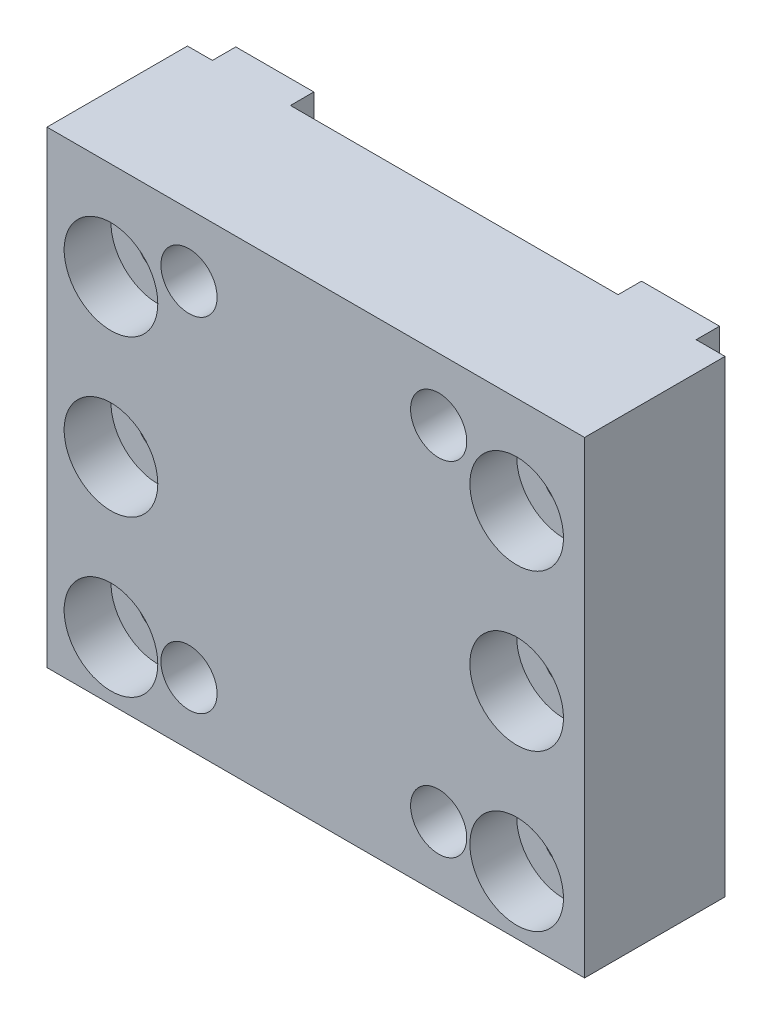
from build123d import *

# Parameters (mm, degrees)
SKETCH_1_W           = 70
SKETCH_1_H           = 30
EXTRUDE_1_DEPTH      = 9
SKETCH_2_W           = 112.1
SKETCH_2_H           = 30
EXTRUDE_2_DEPTH      = 8
SKETCH_3_W           = 42.6
SKETCH_3_H           = 30
EXTRUDE_3_DEPTH      = 8
SKETCH_5_W           = 18.5
SKETCH_5_H           = 30
SKETCH_5_R           = 2
EXTRUDE_4_DEPTH      = 5.5
SKETCH_11_R          = 2
CUT_EXTRUDE_4_DEPTH  = 8
SKETCH_12_R          = 1.8
CUT_EXTRUDE_6_DEPTH  = 8
SKETCH_13_R          = 2
CUT_EXTRUDE_7_DEPTH  = 8
SKETCH_14_R          = 2
CUT_EXTRUDE_8_DEPTH  = 10
SKETCH_19_W          = 5
SKETCH_19_H          = 9
EXTRUDE_6_DEPTH      = 36.25
SKETCH_20_W          = 5
SKETCH_20_H          = 6.25
EXTRUDE_7_DEPTH      = 9
SKETCH_21_R          = 1.3
CUT_EXTRUDE_10_DEPTH = 9
SKETCH_25_W          = 5
SKETCH_25_H          = 1.5
EXTRUDE_8_DEPTH      = 42.5
SKETCH_26_R          = 1.3
CUT_EXTRUDE_14_DEPTH = 1.5
SKETCH_27_W          = 5
SKETCH_27_H          = 6.25
CUT_EXTRUDE_15_DEPTH = 11
SKETCH_28_R          = 3
CUT_EXTRUDE_16_DEPTH = 3
SKETCH_29_W          = 8
SKETCH_29_H          = 103.1
SKETCH_29_W_2        = 10.5
SKETCH_29_H_2        = 5.5
CUT_EXTRUDE_17_DEPTH = 30
SKETCH_30_R          = 1.8
CUT_EXTRUDE_18_DEPTH = 10
SKETCH_31_R          = 3.6
CUT_EXTRUDE_19_DEPTH = 3
SKETCH_32_R          = 1.8
CUT_EXTRUDE_20_DEPTH = 10
SKETCH_33_R          = 3.6
CUT_EXTRUDE_21_DEPTH = 3
CUT_EXTRUDE_22_REACH = 86.054
SKETCH_35_R          = 1.8
SKETCH_36_W          = 7.55
SKETCH_36_H          = 30
CUT_EXTRUDE_23_DEPTH = 10
SKETCH_37_W          = 18
SKETCH_37_H          = 30
SKETCH_37_W_2        = 26
CUT_EXTRUDE_24_DEPTH = 10


with BuildPart() as part:
    # 草圖1 → 填料-伸長1 (new body)
    with BuildSketch(Plane.XY):
        with Locations((35, 15)):
            Rectangle(SKETCH_1_W, SKETCH_1_H)
    extrude(amount=EXTRUDE_1_DEPTH)

    # 草圖2 → 填料-伸長2 (add)
    with BuildSketch(Plane.ZY):
        with Locations((-47.05, 15)):
            Rectangle(SKETCH_2_W, SKETCH_2_H)
    extrude(amount=EXTRUDE_2_DEPTH)

    # 草圖3 → 填料-伸長3 (add)
    with BuildSketch(Plane(origin=(70, 0, 0), x_dir=(0, 0, -1), z_dir=(1, 0, 0))):
        with Locations((12.3, 15)):
            Rectangle(SKETCH_3_W, SKETCH_3_H)
    extrude(amount=EXTRUDE_3_DEPTH)

    # 草圖5 → 填料-伸長4 (add)
    with BuildSketch(Plane(origin=(0, 0, -33.6), x_dir=(-1, 0, 0), z_dir=(0, 0, -1))):
        with Locations((-68.75, 15)):
            Rectangle(SKETCH_5_W, SKETCH_5_H)
        with Locations(Location((-65.75, 26, 0), (0, 0, 90))):
            Circle(SKETCH_5_R, mode=Mode.SUBTRACT)
        with Locations(Location((-65.75, 18, 0), (0, 0, 90))):
            Circle(SKETCH_5_R, mode=Mode.SUBTRACT)
        with Locations(Location((-65.75, 10, 0), (0, 0, 90))):
            Circle(SKETCH_5_R, mode=Mode.SUBTRACT)
    extrude(amount=EXTRUDE_4_DEPTH)

    # 草圖11 → 除料-伸長4 (cut)
    with BuildSketch(Plane.ZY.offset(8)):
        with Locations((-23, 23)):
            Circle(SKETCH_11_R)
        with Locations((-23, 15)):
            Circle(SKETCH_11_R)
        with Locations((-23, 7)):
            Circle(SKETCH_11_R)
        with Locations((-15, 23)):
            Circle(SKETCH_11_R)
        with Locations((-15, 15)):
            Circle(SKETCH_11_R)
        with Locations((-15, 7)):
            Circle(SKETCH_11_R)
        with Locations((-7, 23)):
            Circle(SKETCH_11_R)
        with Locations((-7, 15)):
            Circle(SKETCH_11_R)
        with Locations((-7, 7)):
            Circle(SKETCH_11_R)
    extrude(amount=-CUT_EXTRUDE_4_DEPTH, mode=Mode.SUBTRACT)

    # 草圖12 → 除料-伸長6 (cut)
    with BuildSketch(Plane(origin=(0, 0, -103.1), x_dir=(-1, 0, 0), z_dir=(0, 0, -1))):
        with Locations((3, 23)):
            Circle(SKETCH_12_R)
        with Locations((3, 15)):
            Circle(SKETCH_12_R)
        with Locations((3, 7)):
            Circle(SKETCH_12_R)
    extrude(amount=-CUT_EXTRUDE_6_DEPTH, mode=Mode.SUBTRACT)

    # 草圖13 → 除料-伸長7 (cut)
    with BuildSketch(Plane(origin=(78, 0, 0), x_dir=(0, 0, -1), z_dir=(1, 0, 0))):
        with Locations((9.1, 23)):
            Circle(SKETCH_13_R)
        with Locations((9.1, 15)):
            Circle(SKETCH_13_R)
        with Locations((9.1, 7)):
            Circle(SKETCH_13_R)
        with Locations((17.1, 23)):
            Circle(SKETCH_13_R)
        with Locations((17.1, 15)):
            Circle(SKETCH_13_R)
        with Locations((17.1, 7)):
            Circle(SKETCH_13_R)
        with Locations((25.1, 23)):
            Circle(SKETCH_13_R)
        with Locations((25.1, 15)):
            Circle(SKETCH_13_R)
        with Locations((25.1, 7)):
            Circle(SKETCH_13_R)
    extrude(amount=-CUT_EXTRUDE_7_DEPTH, mode=Mode.SUBTRACT)

    # 草圖14 → 除料-伸長8 (cut)
    with BuildSketch(Plane.ZY.offset(8)):
        with Locations((-85.1, 23)):
            Circle(SKETCH_14_R)
        with Locations((-85.1, 15)):
            Circle(SKETCH_14_R)
        with Locations((-85.1, 7)):
            Circle(SKETCH_14_R)
        with Locations((-77.1, 23)):
            Circle(SKETCH_14_R)
        with Locations((-77.1, 15)):
            Circle(SKETCH_14_R)
        with Locations((-77.1, 7)):
            Circle(SKETCH_14_R)
        with Locations((-69.1, 23)):
            Circle(SKETCH_14_R)
        with Locations((-69.1, 15)):
            Circle(SKETCH_14_R)
        with Locations((-69.1, 7)):
            Circle(SKETCH_14_R)
        with Locations((-61.1, 23)):
            Circle(SKETCH_14_R)
        with Locations((-61.1, 15)):
            Circle(SKETCH_14_R)
        with Locations((-61.1, 7)):
            Circle(SKETCH_14_R)
    extrude(amount=-CUT_EXTRUDE_8_DEPTH, mode=Mode.SUBTRACT)

    # 草圖19 → 填料-伸長6 (add)
    with BuildSketch(Plane(origin=(0, 30, 0), x_dir=(1, 0, 0), z_dir=(0, 1, 0))):
        with Locations((22.1, -4.5)):
            Rectangle(SKETCH_19_W, SKETCH_19_H)
        with Locations((48.1, -4.5)):
            Rectangle(SKETCH_19_W, SKETCH_19_H)
    extrude(amount=-EXTRUDE_6_DEPTH)

    # 草圖20 → 填料-伸長7 (add)
    with BuildSketch(Plane(origin=(0, 0, 0), x_dir=(-1, 0, 0), z_dir=(0, 0, -1))):
        with Locations((-48.1, 33.125)):
            Rectangle(SKETCH_20_W, SKETCH_20_H)
        with Locations((-22.1, 33.125)):
            Rectangle(SKETCH_20_W, SKETCH_20_H)
    extrude(amount=-EXTRUDE_7_DEPTH)

    # 草圖21 → 除料-伸長10 (cut)
    with BuildSketch(Plane(origin=(0, 0, 0), x_dir=(-1, 0, 0), z_dir=(0, 0, -1))):
        with Locations((-48.1, 23.75)):
            Circle(SKETCH_21_R)
        with Locations((-48.1, 13.75)):
            Circle(SKETCH_21_R)
        with Locations((-48.1, 3.75)):
            Circle(SKETCH_21_R)
        with Locations((-22.1, 23.75)):
            Circle(SKETCH_21_R)
        with Locations((-22.1, 13.75)):
            Circle(SKETCH_21_R)
        with Locations((-22.1, 3.75)):
            Circle(SKETCH_21_R)
    extrude(amount=-CUT_EXTRUDE_10_DEPTH, mode=Mode.SUBTRACT)

    # 草圖25 → 填料-伸長8 (add)
    with BuildSketch(Plane(origin=(0, 36.25, 0), x_dir=(1, 0, 0), z_dir=(0, 1, 0))):
        with Locations((22.1, 0.75)):
            Rectangle(SKETCH_25_W, SKETCH_25_H)
        with Locations((48.1, 0.75)):
            Rectangle(SKETCH_25_W, SKETCH_25_H)
    extrude(amount=-EXTRUDE_8_DEPTH)

    # 草圖26 → 除料-伸長14 (cut)
    with BuildSketch(Plane(origin=(0, 0, -1.5), x_dir=(-1, 0, 0), z_dir=(0, 0, -1))):
        with Locations((-48.1, 23.75)):
            Circle(SKETCH_26_R)
        with Locations((-48.1, 13.75)):
            Circle(SKETCH_26_R)
        with Locations((-48.1, 3.75)):
            Circle(SKETCH_26_R)
        with Locations((-22.1, 23.75)):
            Circle(SKETCH_26_R)
        with Locations((-22.1, 13.75)):
            Circle(SKETCH_26_R)
        with Locations((-22.1, 3.75)):
            Circle(SKETCH_26_R)
    extrude(amount=-CUT_EXTRUDE_14_DEPTH, mode=Mode.SUBTRACT)

    # 草圖27 → 除料-伸長15 (cut)
    with BuildSketch(Plane.XY.offset(9)):
        with Locations((22.1, 33.125)):
            Rectangle(SKETCH_27_W, SKETCH_27_H)
        with Locations((48.1, 33.125)):
            Rectangle(SKETCH_27_W, SKETCH_27_H)
        with Locations((22.1, -3.125)):
            Rectangle(SKETCH_27_W, SKETCH_27_H)
        with Locations((48.1, -3.125)):
            Rectangle(SKETCH_27_W, SKETCH_27_H)
    extrude(amount=-CUT_EXTRUDE_15_DEPTH, mode=Mode.SUBTRACT)

    # 草圖28 → 除料-伸長16 (cut)
    with BuildSketch(Plane.XY.offset(9)):
        with Locations((22.1, 23.75)):
            Circle(SKETCH_28_R)
        with Locations((22.1, 13.75)):
            Circle(SKETCH_28_R)
        with Locations((22.1, 3.75)):
            Circle(SKETCH_28_R)
        with Locations((48.1, 13.75)):
            Circle(SKETCH_28_R)
        with Locations((48.1, 3.75)):
            Circle(SKETCH_28_R)
        with Locations((48.1, 23.75)):
            Circle(SKETCH_28_R)
    extrude(amount=-CUT_EXTRUDE_16_DEPTH, mode=Mode.SUBTRACT)

    # 草圖29 → 除料-伸長17 (cut)
    with BuildSketch(Plane(origin=(0, 30, 0), x_dir=(1, 0, 0), z_dir=(0, 1, 0))):
        with Locations((-4, 51.55)):
            Rectangle(SKETCH_29_W, SKETCH_29_H)
        with Locations((64.75, 36.35)):
            Rectangle(SKETCH_29_W_2, SKETCH_29_H_2)
        Polygon((70, 33.6), (70, 0), (78, 0), (78, 39.1), (70, 39.1), align=None)
    extrude(amount=-CUT_EXTRUDE_17_DEPTH, mode=Mode.SUBTRACT)

    # 草圖30 → 除料-伸長18 (cut)
    with BuildSketch(Plane.XY.offset(9)):
        with Locations((-4, 23)):
            Circle(SKETCH_30_R)
        with Locations((-4, 15)):
            Circle(SKETCH_30_R)
        with Locations((-4, 7)):
            Circle(SKETCH_30_R)
    extrude(amount=-CUT_EXTRUDE_18_DEPTH, mode=Mode.SUBTRACT)

    # 草圖31 → 除料-伸長19 (cut)
    with BuildSketch(Plane.XY.offset(9)):
        with Locations((-4, 15)):
            Circle(SKETCH_31_R)
        with Locations((-4, 7)):
            Circle(SKETCH_31_R)
        with Locations((-4, 23)):
            Circle(SKETCH_31_R)
    extrude(amount=-CUT_EXTRUDE_19_DEPTH, mode=Mode.SUBTRACT)

    # 草圖32 → 除料-伸長20 (cut)
    with BuildSketch(Plane.XY.offset(9)):
        with Locations((65.2, 23)):
            Circle(SKETCH_32_R)
        with Locations((65.2, 15)):
            Circle(SKETCH_32_R)
        with Locations((65.2, 7)):
            Circle(SKETCH_32_R)
    extrude(amount=-CUT_EXTRUDE_20_DEPTH, mode=Mode.SUBTRACT)

    # 草圖33 → 除料-伸長21 (cut)
    with BuildSketch(Plane.XY.offset(9)):
        with Locations((65.2, 23)):
            Circle(SKETCH_33_R)
        with Locations((65.2, 15)):
            Circle(SKETCH_33_R)
        with Locations((65.2, 7)):
            Circle(SKETCH_33_R)
    extrude(amount=-CUT_EXTRUDE_21_DEPTH, mode=Mode.SUBTRACT)

    # 草圖35 → 除料-伸長22 (cut, up to next)
    with BuildSketch(Plane(origin=(0, 0, 0), x_dir=(-1, 0, 0), z_dir=(0, 0, -1)), mode=Mode.PRIVATE) as cut_extrude_22_sk1:
        with Locations((-43.1, 4)):
            Circle(SKETCH_35_R)
    cut_extrude_22_tool1 = extrude(cut_extrude_22_sk1.sketch, amount=-CUT_EXTRUDE_22_REACH, mode=Mode.PRIVATE) & part.part
    # 草圖35 → 除料-伸長22 (cut, up to next)
    with BuildSketch(Plane(origin=(0, 0, 0), x_dir=(-1, 0, 0), z_dir=(0, 0, -1)), mode=Mode.PRIVATE) as cut_extrude_22_sk2:
        with Locations((-43.1, 26)):
            Circle(SKETCH_35_R)
    cut_extrude_22_tool2 = extrude(cut_extrude_22_sk2.sketch, amount=-CUT_EXTRUDE_22_REACH, mode=Mode.PRIVATE) & part.part
    # 草圖35 → 除料-伸長22 (cut, up to next)
    with BuildSketch(Plane(origin=(0, 0, 0), x_dir=(-1, 0, 0), z_dir=(0, 0, -1)), mode=Mode.PRIVATE) as cut_extrude_22_sk3:
        with Locations((-27.1, 26)):
            Circle(SKETCH_35_R)
    cut_extrude_22_tool3 = extrude(cut_extrude_22_sk3.sketch, amount=-CUT_EXTRUDE_22_REACH, mode=Mode.PRIVATE) & part.part
    # 草圖35 → 除料-伸長22 (cut, up to next)
    with BuildSketch(Plane(origin=(0, 0, 0), x_dir=(-1, 0, 0), z_dir=(0, 0, -1)), mode=Mode.PRIVATE) as cut_extrude_22_sk4:
        with Locations((-27.1, 4)):
            Circle(SKETCH_35_R)
    cut_extrude_22_tool4 = extrude(cut_extrude_22_sk4.sketch, amount=-CUT_EXTRUDE_22_REACH, mode=Mode.PRIVATE) & part.part
    add(cut_extrude_22_tool1.solids().sort_by_distance((43.1, 4, 0))[0], mode=Mode.SUBTRACT)
    add(cut_extrude_22_tool2.solids().sort_by_distance((43.1, 26, 0))[0], mode=Mode.SUBTRACT)
    add(cut_extrude_22_tool3.solids().sort_by_distance((27.1, 26, 0))[0], mode=Mode.SUBTRACT)
    add(cut_extrude_22_tool4.solids().sort_by_distance((27.1, 4, 0))[0], mode=Mode.SUBTRACT)

    # 草圖36 → 除料-伸長23 (cut)
    with BuildSketch(Plane.XY.offset(9)):
        with Locations((74.225, 15)):
            Rectangle(SKETCH_36_W, SKETCH_36_H)
    extrude(amount=-CUT_EXTRUDE_23_DEPTH, mode=Mode.SUBTRACT)

    # 草圖37 → 除料-伸長24 (cut)
    with BuildSketch(Plane.XY.offset(9)):
        with Locations((61.45, 15)):
            Rectangle(SKETCH_37_W, SKETCH_37_H)
        with Locations((5, 15)):
            Rectangle(SKETCH_37_W_2, SKETCH_37_H)
    extrude(amount=-CUT_EXTRUDE_24_DEPTH, mode=Mode.SUBTRACT)


solid = part.part
